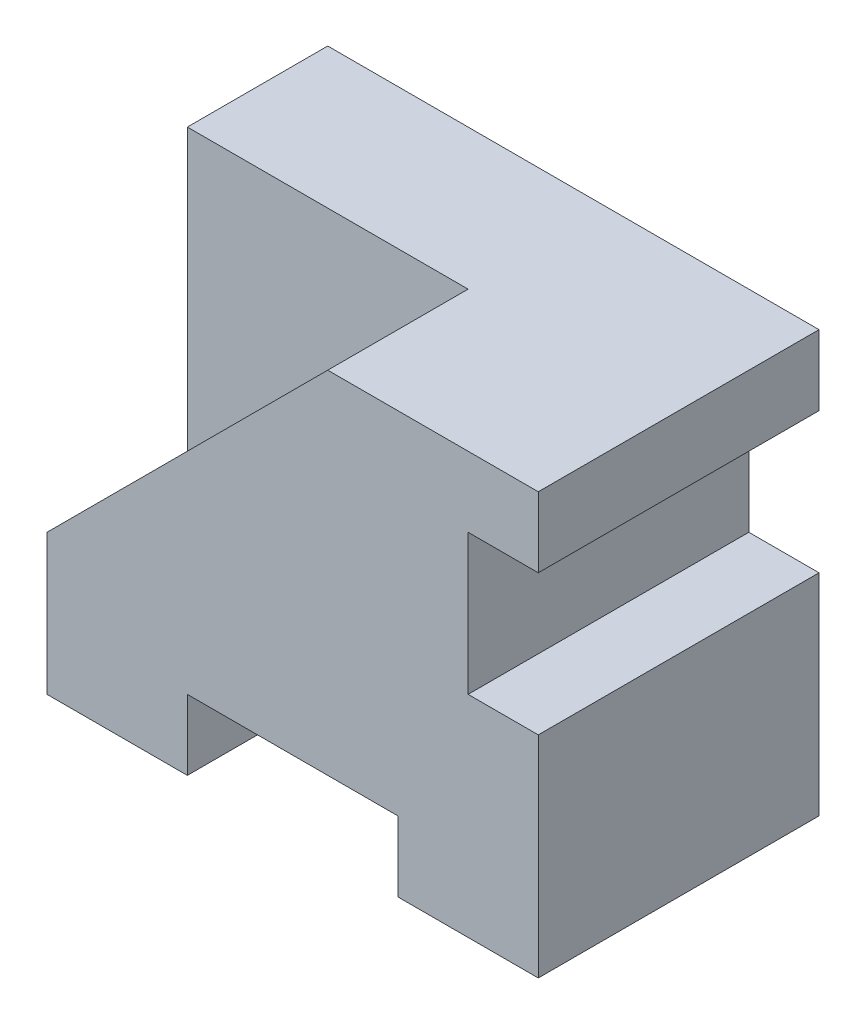
from build123d import *

# Parameters (mm, degrees)
SKETCH1_W               = 70
SKETCH1_H               = 40
BOSS_EXTRUDE1_DEPTH     = 60
SKETCH2_W               = 30
SKETCH2_H               = 10
CUT_EXTRUDE1_DEPTH      = 81.156097709
SKETCH3_W               = 10
SKETCH3_H               = 20
CUT_EXTRUDE2_DEPTH      = 81.156097709
CUT_EXTRUDE3_DEPTH      = 81.156097709
CUT_EXTRUDE3_DEPTH_BACK = 20


with BuildPart() as part:
    # Sketch1 → Boss-Extrude1 (new body)
    with BuildSketch(Plane(origin=(0, 0, 0), x_dir=(1, 0, 0), z_dir=(0, 1, 0))):
        Rectangle(SKETCH1_W, SKETCH1_H)
    extrude(amount=BOSS_EXTRUDE1_DEPTH)

    # Sketch2 → Cut-Extrude1 (cut, through all)
    with BuildSketch(Plane.XY.offset(20)):
        with Locations((0, 5)):
            Rectangle(SKETCH2_W, SKETCH2_H)
    extrude(amount=-CUT_EXTRUDE1_DEPTH, mode=Mode.SUBTRACT)

    # Sketch3 → Cut-Extrude2 (cut, through all)
    with BuildSketch(Plane.XY.offset(20)):
        with Locations((30, 40)):
            Rectangle(SKETCH3_W, SKETCH3_H)
    extrude(amount=-CUT_EXTRUDE2_DEPTH, mode=Mode.SUBTRACT)

    # Sketch4 → Cut-Extrude3 (cut, two sides: drawn at the far end of the back side and taken through both)
    with BuildSketch(Plane.XY.offset(20).offset(-CUT_EXTRUDE3_DEPTH_BACK)):
        Polygon((-156.088610322, -101.088610322), (-35, 20), (5, 60), (126.088610322, 181.088610322), (-116.088610322, 423.265830965), (-398.265830965, 141.088610322), align=None)
    extrude(amount=CUT_EXTRUDE3_DEPTH + CUT_EXTRUDE3_DEPTH_BACK, mode=Mode.SUBTRACT)


solid = part.part
